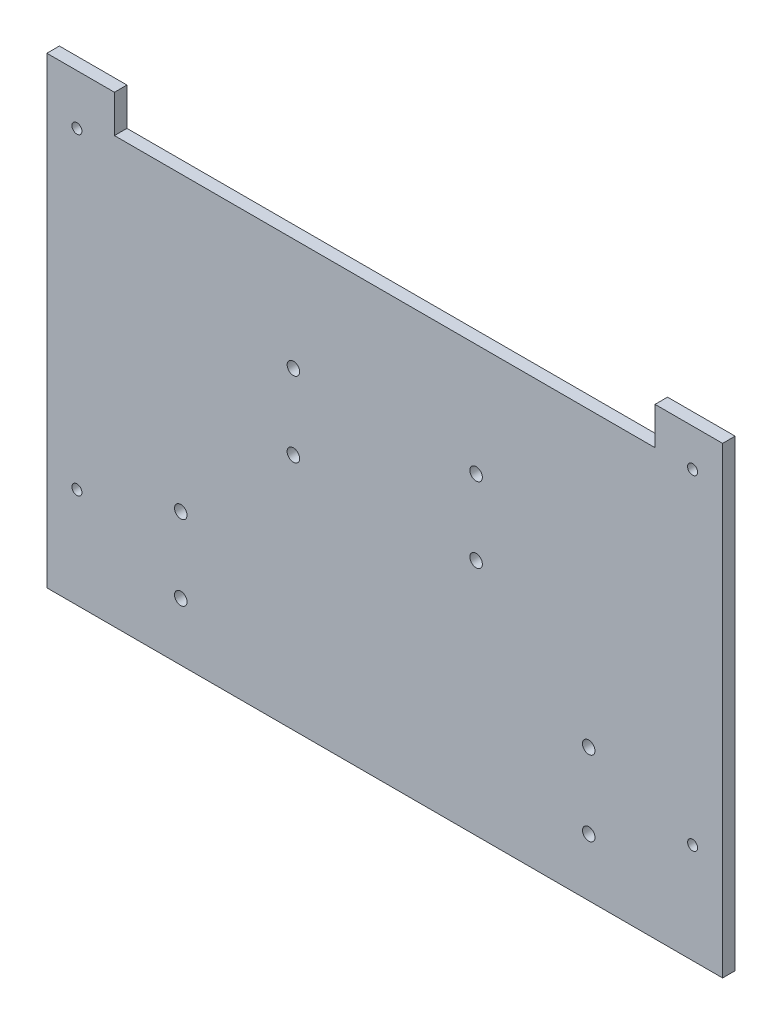
from build123d import *

# Parameters (mm, degrees)
BOSS_EXTRU_1_DEPTH      = 5
ESQUISSE2_R             = 2
ENL_V_MAT_EXTRU_1_DEPTH = 169.07736314
SKETCH1_R               = 2.5
CUT_EXTRUDE1_DEPTH      = 169.07736314
SKETCH2_R               = 2.5
CUT_EXTRUDE2_DEPTH      = 24


with BuildPart() as part:
    # Esquisse1 → Boss.-Extru.1 (new body)
    with BuildSketch(Plane.XY):
        Polygon((-135, 85), (-135, 100), (-108, 100), (-108, 85), (108, 85), (108, 100), (135, 100), (135, 85), (135, -85), (-135, -85), align=None)
    extrude(amount=BOSS_EXTRU_1_DEPTH)

    # Esquisse2 → Enlèv. mat.-Extru.1 (cut, through all)
    with BuildSketch(Plane.XY.offset(5)):
        with Locations((-123, -45)):
            Circle(ESQUISSE2_R)
        with Locations((-123, 80)):
            Circle(ESQUISSE2_R)
        with Locations((123, -45)):
            Circle(ESQUISSE2_R)
        with Locations((123, 85)):
            Circle(ESQUISSE2_R)
    extrude(amount=-ENL_V_MAT_EXTRU_1_DEPTH, mode=Mode.SUBTRACT)

    # Sketch1 → Cut-Extrude1 (cut, through all)
    with BuildSketch(Plane.XY.offset(5)):
        with Locations((81.5, -31.885578019)):
            Circle(SKETCH1_R)
        with Locations((81.5, -61.885578019)):
            Circle(SKETCH1_R)
        with Locations((-81.5, -61.885578019)):
            Circle(SKETCH1_R)
        with Locations((-81.5, -31.885578019)):
            Circle(SKETCH1_R)
    extrude(amount=-CUT_EXTRUDE1_DEPTH, mode=Mode.SUBTRACT)

    # Sketch2 → Cut-Extrude2 (cut)
    with BuildSketch(Plane.XY.offset(5)):
        with Locations((36.5, 40.213230892)):
            Circle(SKETCH2_R)
        with Locations((36.5, 10.213230892)):
            Circle(SKETCH2_R)
        with Locations((-36.5, 10.213230892)):
            Circle(SKETCH2_R)
        with Locations((-36.5, 40.213230892)):
            Circle(SKETCH2_R)
    extrude(amount=-CUT_EXTRUDE2_DEPTH, mode=Mode.SUBTRACT)


solid = part.part
